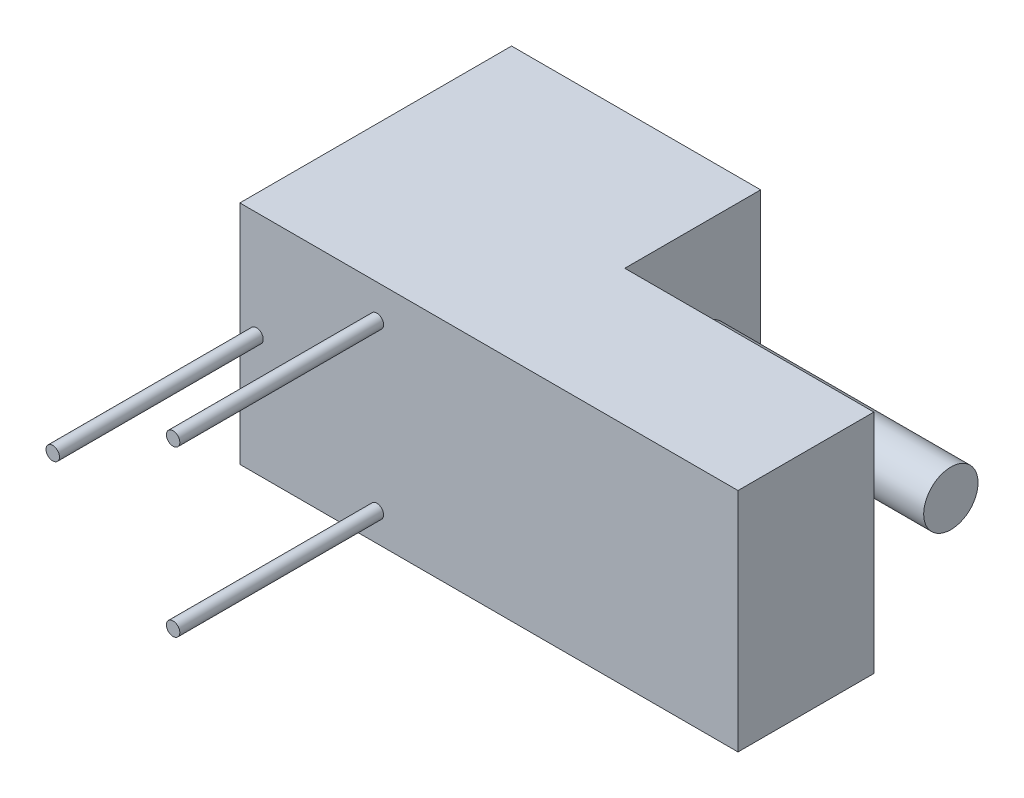
from build123d import *

# Parameters (mm, degrees)
SKETCH_1_W          = 11
SKETCH_1_H          = 5
EXTRUDE_2_DEPTH     = 6
CUT_EXTRUDE_2_DEPTH = 10.552486587
SKETCH_3_R          = 0.6
EXTRUDE_3_DEPTH     = 5.5
SKETCH_4_R          = 0.14862502
EXTRUDE_4_DEPTH     = 4.5


with BuildPart() as part:
    # 草图1 → 拉伸2 (new body)
    with BuildSketch(Plane.XY):
        Rectangle(SKETCH_1_W, SKETCH_1_H)
    extrude(amount=EXTRUDE_2_DEPTH)

    # 草图2 → 切除-拉伸2 (cut, through all)
    with BuildSketch(Plane(origin=(0, 2.5, 0), x_dir=(-1, 0, 0), z_dir=(0, 1, 0))):
        Polygon((-44.7283548, 3), (-7.684787792, 3), (0, 3), (0, -1.817199173), (0, -38.860766181), (-50.624833681, -92.953553513), (-95.353188481, -51.092787332), align=None)
    extrude(amount=-CUT_EXTRUDE_2_DEPTH, mode=Mode.SUBTRACT)

    # 草图3 → 拉伸3 (add)
    with BuildSketch(Plane(origin=(0, 0, 0), x_dir=(0, 0, -1), z_dir=(1, 0, 0))):
        with Locations(Location((-1.3, 0, 0), (0, 0, 270))):
            Circle(SKETCH_3_R)
    extrude(amount=EXTRUDE_3_DEPTH)

    # 草图4 → 拉伸4 (add)
    with BuildSketch(Plane.XY.offset(6)):
        with Locations((-5.13193451, 0.14862502)):
            Circle(SKETCH_4_R)
        with Locations((-2.474169448, 1.757272294)):
            Circle(SKETCH_4_R)
        with Locations((-2.474169448, -1.879669369)):
            Circle(SKETCH_4_R)
    extrude(amount=EXTRUDE_4_DEPTH)


solid = part.part
